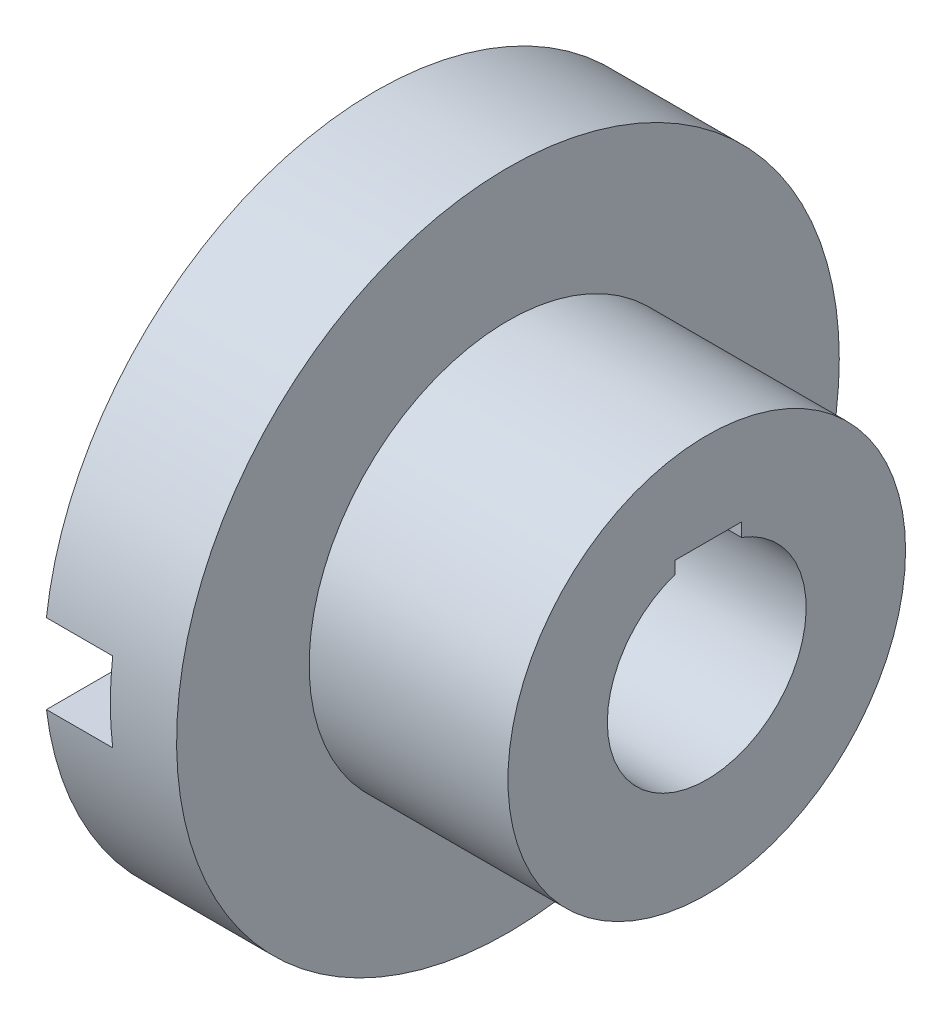
from build123d import *

# Parameters (mm, degrees)
SKETCH1_R           = 50
BOSS_EXTRUDE1_DEPTH = 20
SKETCH2_R           = 30
BOSS_EXTRUDE2_DEPTH = 30
CUT_EXTRUDE1_DEPTH  = 50
CUT_EXTRUDE2_DEPTH  = 10


with BuildPart() as part:
    # Sketch1 → Boss-Extrude1 (new body)
    with BuildSketch(Plane(origin=(0, 0, 0), x_dir=(0, 0, -1), z_dir=(1, 0, 0))):
        Circle(SKETCH1_R)
    extrude(amount=BOSS_EXTRUDE1_DEPTH)

    # Sketch2 → Boss-Extrude2 (add)
    with BuildSketch(Plane(origin=(20, 0, 0), x_dir=(0, 0, -1), z_dir=(1, 0, 0))):
        Circle(SKETCH2_R)
    extrude(amount=BOSS_EXTRUDE2_DEPTH)

    # Sketch3 → Cut-Extrude1 (cut)
    with BuildSketch(Plane.ZY):
        with BuildLine():
            Line((-5.23333009, 16.081894033), (4.76666991, 16.081894033))
            Line((4.76666991, 16.081894033), (4.76666991, 14.222477209))
            ThreePointArc((4.76666991, 14.222477209), (0.247488145, -14.997958182), (-5.23333009, 14.05746265))
            Line((-5.23333009, 14.05746265), (-5.23333009, 16.081894033))
        make_face()
    extrude(amount=-CUT_EXTRUDE1_DEPTH, mode=Mode.SUBTRACT)

    # Sketch4 → Cut-Extrude2 (cut)
    with BuildSketch(Plane.ZY):
        with BuildLine():
            Line((-13.747727085, 6), (-49.638694584, 6))
            ThreePointArc((-49.638694584, 6), (-50, 0), (-49.638694584, -6))
            Line((-49.638694584, -6), (-13.747727085, -6))
            ThreePointArc((-13.747727085, -6), (-15, 0), (-13.747727085, 6))
        make_face()
        with BuildLine():
            ThreePointArc((50, 0), (49.90959191, 3.005434312), (49.638694584, 6))
            Line((49.638694584, 6), (13.747727085, 6))
            ThreePointArc((13.747727085, 6), (15, 0), (13.747727085, -6))
            Line((13.747727085, -6), (49.638694584, -6))
            ThreePointArc((49.638694584, -6), (49.90959191, -3.005434312), (50, 0))
        make_face()
    extrude(amount=-CUT_EXTRUDE2_DEPTH, mode=Mode.SUBTRACT)


solid = part.part
